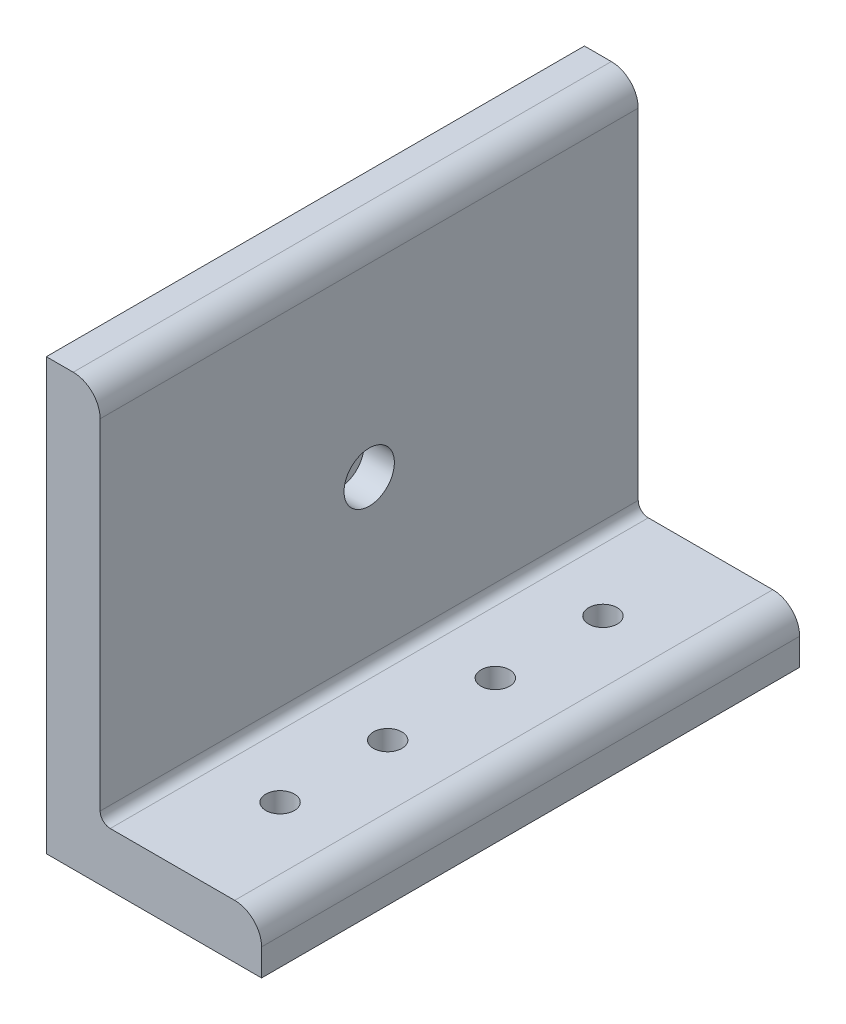
from build123d import *

# Parameters (mm, degrees)
L_ANGLE_L8X4X1_1_DEPTH                   = 254
F_1_2_CLEARANCE_HOLE1_D                  = 13.49248
CBORE_FOR_M12_HEX_HEAD_BOLT1_D           = 13.5
CBORE_FOR_M12_HEX_HEAD_BOLT1_CBORE_D     = 23.78
CBORE_FOR_M12_HEX_HEAD_BOLT1_CBORE_DEPTH = 14.3


with BuildPart() as part:
    # Sketch114 → L angle L8X4X1(1) (new body)
    with BuildSketch(Plane(origin=(390.937425431, -221.174980879, -159.063896304), x_dir=(1, 0, 0), z_dir=(0, 0, 1))):
        with BuildLine():
            Line((0, 0), (0, 203.2))
            Line((0, 203.2), (12.70508, 203.2))
            ThreePointArc((12.70508, 203.2), (21.681744019, 199.481744019), (25.4, 190.50508))
            Line((25.4, 190.50508), (25.4, 30.1625))
            ThreePointArc((25.4, 30.1625), (26.794903955, 26.794903955), (30.1625, 25.4))
            Line((30.1625, 25.4), (88.90508, 25.4))
            ThreePointArc((88.90508, 25.4), (97.881744019, 21.681744019), (101.6, 12.70508))
            Line((101.6, 12.70508), (101.6, 0))
            Line((101.6, 0), (0, 0))
        make_face()
    extrude(amount=L_ANGLE_L8X4X1_1_DEPTH)

    # 1/2 Clearance Hole1 (through all)
    with Locations(Plane(origin=(0, -195.774980879, 0), x_dir=(1, 0, 0), z_dir=(0, 1, 0))):
        with Locations((450.471215431, -44.136103696), (450.471215431, 108.263896304), (450.471215431, 57.463896304), (450.471215431, 6.663896304)):
            Hole(F_1_2_CLEARANCE_HOLE1_D / 2)

    # CBORE for M12 Hex Head Bolt1 (through all)
    with Locations(Plane(origin=(416.337425431, 0, 0), x_dir=(0, 0, -1), z_dir=(1, 0, 0))):
        with Locations((32.063896304, -118.000180879)):
            CounterBoreHole(CBORE_FOR_M12_HEX_HEAD_BOLT1_D / 2, CBORE_FOR_M12_HEX_HEAD_BOLT1_CBORE_D / 2, CBORE_FOR_M12_HEX_HEAD_BOLT1_CBORE_DEPTH)


solid = part.part
